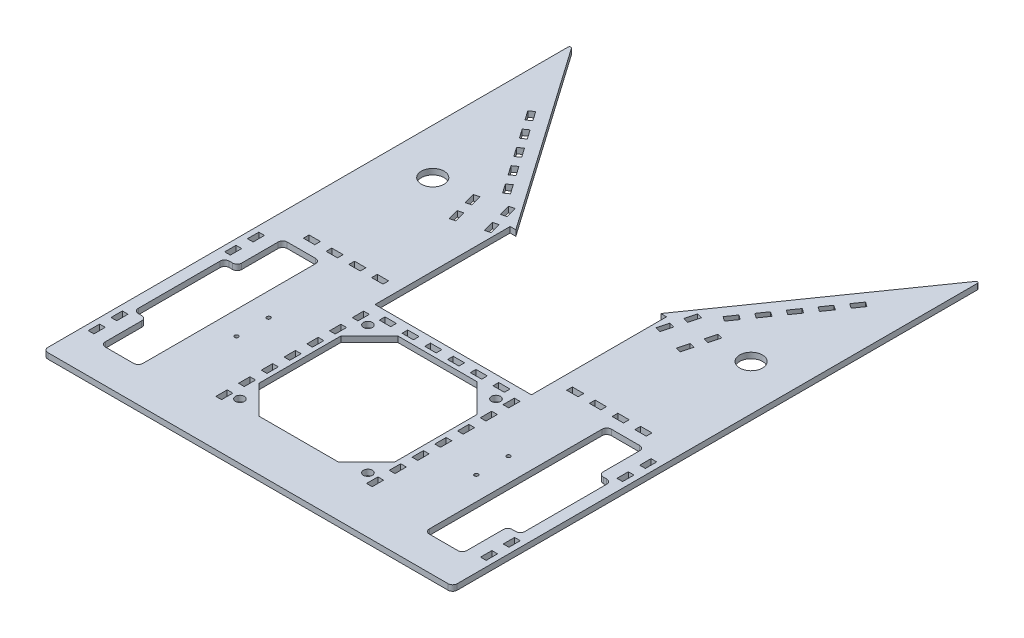
from build123d import *

# Parameters (mm, degrees)
SKETCH1_R           = 1.0541
SKETCH1_R_2         = 2.5
SKETCH1_R_3         = 6.35
SKETCH1_W           = 3.175
SKETCH1_H           = 6.35
SKETCH1_W_2         = 6.35
SKETCH1_H_2         = 3.175
BOSS_EXTRUDE1_DEPTH = 3.175
FILLET1_R           = 2.54
FILLET3_R           = 0.79375


with BuildPart() as part:
    # Sketch1 → Boss-Extrude1 (new body)
    with BuildSketch(Plane(origin=(0, 0, 0), x_dir=(1, 0, 0), z_dir=(0, 1, 0))):
        Polygon((0, 0), (0, 279.4), (70.625, 178.425), (73.8, 173.88559292), (70.625, 173.88559292), (70.625, 98.425), (157.975, 98.425), (157.975, 173.88559292), (154.8, 173.88559292), (157.975, 178.425), (228.6, 279.4), (228.6, 0), (228.6, -16.1925), (0, -16.1925), align=None)
        with Locations(Location((181.26, 44.34, 0), (0, 0, 270))):
            Circle(SKETCH1_R, mode=Mode.SUBTRACT)
        with Locations(Location((181.26, 62.34, 0), (0, 0, 270))):
            Circle(SKETCH1_R, mode=Mode.SUBTRACT)
        with Locations(Location((47.34, 62.34, 0), (0, 0, 90))):
            Circle(SKETCH1_R, mode=Mode.SUBTRACT)
        with Locations(Location((47.34, 44.34, 0), (0, 0, 90))):
            Circle(SKETCH1_R, mode=Mode.SUBTRACT)
        with Locations(Location((78.55, 15.05, 0), (0, 0, 270))):
            Circle(SKETCH1_R_2, mode=Mode.SUBTRACT)
        with Locations(Location((78.55, 86.55, 0), (0, 0, 270))):
            Circle(SKETCH1_R_2, mode=Mode.SUBTRACT)
        with Locations(Location((150.05, 15.05, 0), (0, 0, 90))):
            Circle(SKETCH1_R_2, mode=Mode.SUBTRACT)
        with Locations(Location((150.05, 86.55, 0), (0, 0, 90))):
            Circle(SKETCH1_R_2, mode=Mode.SUBTRACT)
        with Locations(Location((203.2, 175.885, 0), (0, 0, 270))):
            Circle(SKETCH1_R_3, mode=Mode.SUBTRACT)
        with Locations(Location((25.4, 175.885, 0), (0, 0, 90))):
            Circle(SKETCH1_R_3, mode=Mode.SUBTRACT)
        Polygon((194.31, 2.54), (215.265, 2.54), (215.265, 27.94), (222.25, 27.94), (222.25, 78.74), (215.265, 78.74), (215.265, 104.14), (194.31, 104.14), align=None, mode=Mode.SUBTRACT)
        Polygon((13.335, 104.14), (13.335, 78.74), (6.35, 78.74), (6.35, 27.94), (13.335, 27.94), (13.335, 2.54), (34.29, 2.54), (34.29, 104.14), align=None, mode=Mode.SUBTRACT)
        with Locations((156.3875, 88.9)):
            Rectangle(SKETCH1_W, SKETCH1_H, mode=Mode.SUBTRACT)
        with Locations((72.2125, 50.8)):
            Rectangle(SKETCH1_W, SKETCH1_H, mode=Mode.SUBTRACT)
        with Locations((72.2125, 38.1)):
            Rectangle(SKETCH1_W, SKETCH1_H, mode=Mode.SUBTRACT)
        with Locations((72.2125, 25.4)):
            Rectangle(SKETCH1_W, SKETCH1_H, mode=Mode.SUBTRACT)
        with Locations((72.2125, 12.7)):
            Rectangle(SKETCH1_W, SKETCH1_H, mode=Mode.SUBTRACT)
        with Locations((72.2125, 63.5)):
            Rectangle(SKETCH1_W, SKETCH1_H, mode=Mode.SUBTRACT)
        with Locations((72.2125, 76.2)):
            Rectangle(SKETCH1_W, SKETCH1_H, mode=Mode.SUBTRACT)
        with Locations((72.2125, 88.9)):
            Rectangle(SKETCH1_W, SKETCH1_H, mode=Mode.SUBTRACT)
        with Locations((156.3875, 76.2)):
            Rectangle(SKETCH1_W, SKETCH1_H, mode=Mode.SUBTRACT)
        with Locations((156.3875, 63.5)):
            Rectangle(SKETCH1_W, SKETCH1_H, mode=Mode.SUBTRACT)
        with Locations((156.3875, 12.7)):
            Rectangle(SKETCH1_W, SKETCH1_H, mode=Mode.SUBTRACT)
        with Locations((156.3875, 25.4)):
            Rectangle(SKETCH1_W, SKETCH1_H, mode=Mode.SUBTRACT)
        with Locations((156.3875, 38.1)):
            Rectangle(SKETCH1_W, SKETCH1_H, mode=Mode.SUBTRACT)
        with Locations((156.3875, 50.8)):
            Rectangle(SKETCH1_W, SKETCH1_H, mode=Mode.SUBTRACT)
        with Locations((133.35, 93.6625)):
            Rectangle(SKETCH1_W_2, SKETCH1_H_2, mode=Mode.SUBTRACT)
        with Locations((146.05, 93.6625)):
            Rectangle(SKETCH1_W_2, SKETCH1_H_2, mode=Mode.SUBTRACT)
        with Locations((120.65, 93.6625)):
            Rectangle(SKETCH1_W_2, SKETCH1_H_2, mode=Mode.SUBTRACT)
        with Locations((107.95, 93.6625)):
            Rectangle(SKETCH1_W_2, SKETCH1_H_2, mode=Mode.SUBTRACT)
        with Locations((95.25, 93.6625)):
            Rectangle(SKETCH1_W_2, SKETCH1_H_2, mode=Mode.SUBTRACT)
        with Locations((82.55, 93.6625)):
            Rectangle(SKETCH1_W_2, SKETCH1_H_2, mode=Mode.SUBTRACT)
        with Locations((223.8375, 97.79)):
            Rectangle(SKETCH1_W, SKETCH1_H, mode=Mode.SUBTRACT)
        with Locations((223.8375, 21.59)):
            Rectangle(SKETCH1_W, SKETCH1_H, mode=Mode.SUBTRACT)
        with Locations((223.8375, 8.89)):
            Rectangle(SKETCH1_W, SKETCH1_H, mode=Mode.SUBTRACT)
        with Locations((223.8375, 85.09)):
            Rectangle(SKETCH1_W, SKETCH1_H, mode=Mode.SUBTRACT)
        with Locations((4.7625, 85.09)):
            Rectangle(SKETCH1_W, SKETCH1_H, mode=Mode.SUBTRACT)
        with Locations((4.7625, 97.79)):
            Rectangle(SKETCH1_W, SKETCH1_H, mode=Mode.SUBTRACT)
        with Locations((4.7625, 8.89)):
            Rectangle(SKETCH1_W, SKETCH1_H, mode=Mode.SUBTRACT)
        with Locations((4.7625, 21.59)):
            Rectangle(SKETCH1_W, SKETCH1_H, mode=Mode.SUBTRACT)
        Polygon((173.658953433, 189.769748471), (177.298450375, 194.973262861), (179.90020757, 193.15351439), (176.260710628, 187.95), align=None, mode=Mode.SUBTRACT)
        Polygon((180.937947318, 200.176777251), (183.539704513, 198.35702878), (187.179201455, 203.560543169), (184.57744426, 205.380291641), align=None, mode=Mode.SUBTRACT)
        Polygon((29.464567969, 226.1943492), (33.104064912, 220.99083481), (30.502307717, 219.171086339), (26.862810774, 224.374600729), align=None, mode=Mode.SUBTRACT)
        Polygon((188.216941203, 210.58380603), (191.856438146, 215.78732042), (194.458195341, 213.967571949), (190.818698398, 208.764057559), align=None, mode=Mode.SUBTRACT)
        Polygon((195.495935088, 220.99083481), (198.097692283, 219.171086339), (201.737189226, 224.374600729), (199.135432031, 226.1943492), align=None, mode=Mode.SUBTRACT)
        Polygon((36.743561854, 215.78732042), (34.141804659, 213.967571949), (37.781301602, 208.764057559), (40.383058797, 210.58380603), align=None, mode=Mode.SUBTRACT)
        Polygon((47.662052682, 200.176777251), (45.060295487, 198.35702878), (41.420798545, 203.560543169), (44.02255574, 205.380291641), align=None, mode=Mode.SUBTRACT)
        Polygon((51.301549625, 194.973262861), (48.69979243, 193.15351439), (52.339289372, 187.95), (54.941046567, 189.769748471), align=None, mode=Mode.SUBTRACT)
        Polygon((202.774928974, 231.39786359), (205.376686168, 229.578115118), (209.016183111, 234.781629508), (206.414425916, 236.601377979), align=None, mode=Mode.SUBTRACT)
        Polygon((22.185574084, 236.601377979), (19.583816889, 234.781629508), (23.223313832, 229.578115118), (25.825071026, 231.39786359), align=None, mode=Mode.SUBTRACT)
        Polygon((76.3, 73.693398282), (76.3, 27.906601718), (92.181601718, 12.025), (136.418398282, 12.025), (152.3, 27.906601718), (152.3, 73.693398282), (136.418398282, 89.575), (92.181601718, 89.575), align=None, mode=Mode.SUBTRACT)
        Polygon((165.286752809, 183.98125), (163.643251873, 177.847621003), (166.538324759, 177.071888561), (168.181825696, 183.205517558), align=None, mode=Mode.SUBTRACT)
        Polygon((180.792566913, 179.826479633), (179.149065977, 173.692850636), (182.044138864, 172.917118194), (183.6876398, 179.050747191), align=None, mode=Mode.SUBTRACT)
        Polygon((161.999750936, 171.713992006), (160.35625, 165.580363009), (163.251322887, 164.804630567), (164.894823823, 170.938259564), align=None, mode=Mode.SUBTRACT)
        Polygon((177.505565041, 167.559221639), (175.862064104, 161.425592642), (178.757136991, 160.6498602), (180.400637927, 166.783489197), align=None, mode=Mode.SUBTRACT)
        Polygon((48.199362073, 166.783489197), (49.842863009, 160.6498602), (52.737935896, 161.425592642), (51.094434959, 167.559221639), align=None, mode=Mode.SUBTRACT)
        Polygon((63.705176177, 170.938259564), (65.348677113, 164.804630567), (68.24375, 165.580363009), (66.600249064, 171.713992006), align=None, mode=Mode.SUBTRACT)
        Polygon((44.9123602, 179.050747191), (46.555861136, 172.917118194), (49.450934023, 173.692850636), (47.807433087, 179.826479633), align=None, mode=Mode.SUBTRACT)
        Polygon((60.418174304, 183.205517558), (62.061675241, 177.071888561), (64.956748127, 177.847621003), (63.313247191, 183.98125), align=None, mode=Mode.SUBTRACT)
        with Locations((47.13, 112.0775)):
            Rectangle(SKETCH1_W_2, SKETCH1_H_2, mode=Mode.SUBTRACT)
        with Locations((59.83, 112.0775)):
            Rectangle(SKETCH1_W_2, SKETCH1_H_2, mode=Mode.SUBTRACT)
        with Locations((34.43, 112.0775)):
            Rectangle(SKETCH1_W_2, SKETCH1_H_2, mode=Mode.SUBTRACT)
        with Locations((21.73, 112.0775)):
            Rectangle(SKETCH1_W_2, SKETCH1_H_2, mode=Mode.SUBTRACT)
        with Locations((206.87, 112.0775)):
            Rectangle(SKETCH1_W_2, SKETCH1_H_2, mode=Mode.SUBTRACT)
        with Locations((194.17, 112.0775)):
            Rectangle(SKETCH1_W_2, SKETCH1_H_2, mode=Mode.SUBTRACT)
        with Locations((181.47, 112.0775)):
            Rectangle(SKETCH1_W_2, SKETCH1_H_2, mode=Mode.SUBTRACT)
        with Locations((168.77, 112.0775)):
            Rectangle(SKETCH1_W_2, SKETCH1_H_2, mode=Mode.SUBTRACT)
    extrude(amount=BOSS_EXTRUDE1_DEPTH)

    # Fillet1
    fillet1_edges = [part.edges().sort_by_distance(p)[0] for p in [
        (228.6, 1.5875, 16.1925),
        (0, 1.5875, 16.1925),
        (194.31, 1.5875, -104.14),
        (194.31, 1.5875, -2.54),
        (215.265, 1.5875, -2.54),
        (215.265, 1.5875, -27.94),
        (222.25, 1.5875, -27.94),
        (222.25, 1.5875, -78.74),
        (215.265, 1.5875, -78.74),
        (215.265, 1.5875, -104.14),
        (34.29, 1.5875, -104.14),
        (13.335, 1.5875, -104.14),
        (13.335, 1.5875, -78.74),
        (6.35, 1.5875, -78.74),
        (6.35, 1.5875, -27.94),
        (13.335, 1.5875, -27.94),
        (13.335, 1.5875, -2.54),
        (34.29, 1.5875, -2.54),
    ]]
    fillet(fillet1_edges, radius=FILLET1_R)

    # Fillet3
    fillet3_edges = [part.edges().sort_by_distance(p)[0] for p in [
        (0, 1.5875, -279.4),
        (228.6, 1.5875, -279.4),
    ]]
    fillet(fillet3_edges, radius=FILLET3_R)


solid = part.part
